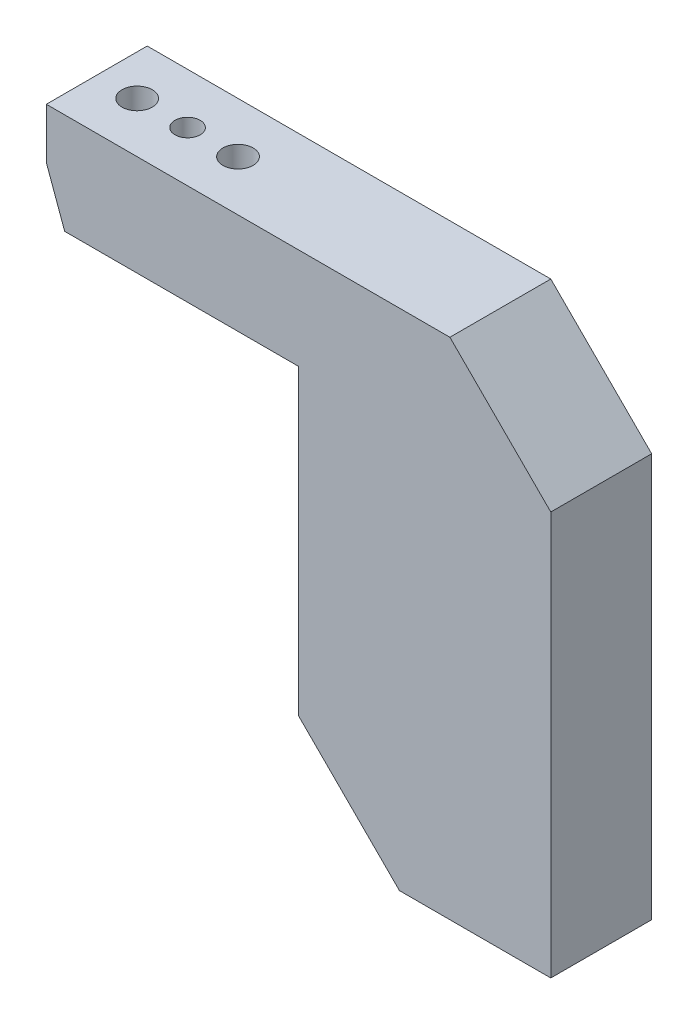
from build123d import *

# Parameters (mm, degrees)
SKETCH_1_W             = 100
SKETCH_1_H             = 100
EXTRUDE_1_DEPTH        = 20
MM_1_D                 = 6
MM_1_DEPTH             = 20
MM_1_TIP               = 1.802581857
HOLE_WIZARD_M6_1_D     = 5
HOLE_WIZARD_M6_1_DEPTH = 15
HOLE_WIZARD_M6_1_TIP   = 1.502151548
SKETCH_6_W             = 50
SKETCH_6_H             = 80
CUT_EXTRUDE_1_DEPTH    = 74.484692283
CHAMFER_1_SIZE         = 10
CHAMFER_1_SIZE2        = 3.639702343
CHAMFER_2_SIZE         = 20
CHAMFER_3_SIZE         = 20


with BuildPart() as part:
    # 草图1 → 凸台-拉伸1 (new body)
    with BuildSketch(Plane.XY):
        Rectangle(SKETCH_1_W, SKETCH_1_H)
    extrude(amount=EXTRUDE_1_DEPTH)

    # 大小mm 暗销孔1
    with Locations(Plane(origin=(0, 50, 0), x_dir=(1, 0, 0), z_dir=(0, 1, 0))):
        with Locations((-22, -10), (-42, -10)):
            Hole(MM_1_D / 2, depth=MM_1_DEPTH)
            with Locations((0, 0, -(MM_1_DEPTH + MM_1_TIP / 2))):  # 118° drill point
                Cone(0, MM_1_D / 2, MM_1_TIP, mode=Mode.SUBTRACT)

    # M6 螺纹孔1
    with Locations(Plane(origin=(0, 50, 0), x_dir=(1, 0, 0), z_dir=(0, 1, 0))):
        with Locations((-32, -10)):
            Hole(HOLE_WIZARD_M6_1_D / 2, depth=HOLE_WIZARD_M6_1_DEPTH)
            with Locations((0, 0, -(HOLE_WIZARD_M6_1_DEPTH + HOLE_WIZARD_M6_1_TIP / 2))):  # 118° drill point
                Cone(0, HOLE_WIZARD_M6_1_D / 2, HOLE_WIZARD_M6_1_TIP, mode=Mode.SUBTRACT)

    # 草图6 → 切除-拉伸1 (cut, through all)
    with BuildSketch(Plane(origin=(0, 0, 0), x_dir=(-1, 0, 0), z_dir=(0, 0, -1))):
        with Locations((25, -10)):
            Rectangle(SKETCH_6_W, SKETCH_6_H)
    extrude(amount=-CUT_EXTRUDE_1_DEPTH, mode=Mode.SUBTRACT)

    # 倒角1
    chamfer_1_edges = [part.edges().sort_by_distance(p)[0] for p in [
        (-50, 30, 10),
    ]]
    chamfer_1_side = [part.faces().sort_by_distance(p)[0] for p in [
        (-50, 40, 10),
    ]]
    chamfer(chamfer_1_edges, length=CHAMFER_1_SIZE, length2=CHAMFER_1_SIZE2, reference=chamfer_1_side[0])

    # 倒角2
    chamfer_2_edges = [part.edges().sort_by_distance(p)[0] for p in [
        (0, -50, 10),
    ]]
    chamfer(chamfer_2_edges, length=CHAMFER_2_SIZE)

    # 倒角3
    chamfer_3_edges = [part.edges().sort_by_distance(p)[0] for p in [
        (50, 50, 10),
    ]]
    chamfer(chamfer_3_edges, length=CHAMFER_3_SIZE)


solid = part.part
